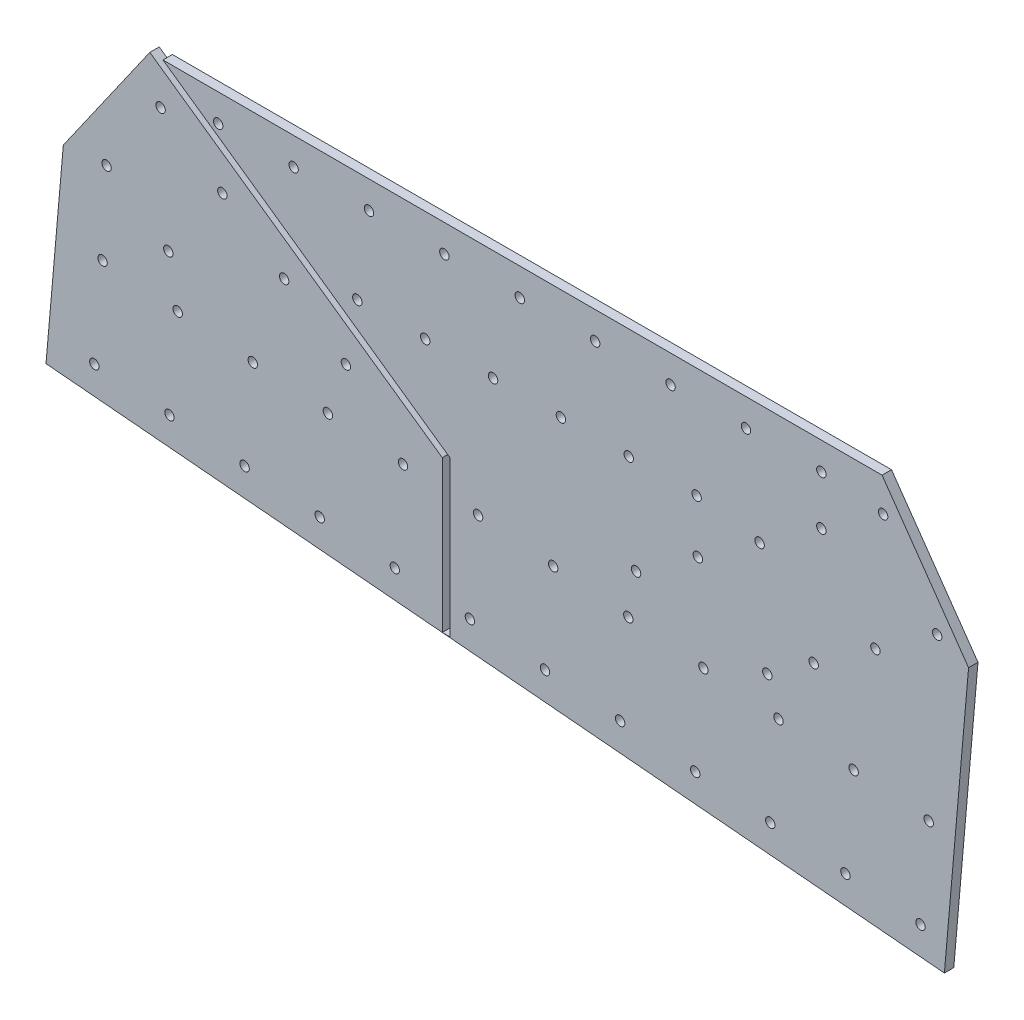
from build123d import *

# Parameters (mm, degrees)
BOSS_EXTRUDE1_DEPTH = 3.175
SKETCH2_R           = 1.5875
CUT_EXTRUDE1_DEPTH  = 3.175
CUT_EXTRUDE2_REACH  = 379.721


with BuildPart() as part:
    # Sketch1 → Boss-Extrude1 (new body)
    with BuildSketch(Plane.XY):
        Polygon((-79.850081257, 25.4), (-50.712398291, -16.21292385), (-58.863628506, -109.381911546), (-361.522202617, -82.902717393), (-355.687601709, -16.21292385), (-326.549918742, 25.4), align=None)
    extrude(amount=BOSS_EXTRUDE1_DEPTH)

    # Sketch2 → Cut-Extrude1 (cut)
    with BuildSketch(Plane.XY.offset(3.175)):
        with Locations((-66.89523724, -99.240960223)):
            Circle(SKETCH2_R)
        with Locations((-92.198582572, -97.027204357)):
            Circle(SKETCH2_R)
        with Locations((-117.501927903, -94.813448491)):
            Circle(SKETCH2_R)
        with Locations((-142.805273235, -92.599692625)):
            Circle(SKETCH2_R)
        with Locations((-168.108618566, -90.38593676)):
            Circle(SKETCH2_R)
        with Locations((-193.411963898, -88.172180894)):
            Circle(SKETCH2_R)
        with Locations((-218.715309229, -85.958425028)):
            Circle(SKETCH2_R)
        with Locations((-244.018654561, -83.744669162)):
            Circle(SKETCH2_R)
        with Locations((-269.321999892, -81.530913296)):
            Circle(SKETCH2_R)
        with Locations((-294.625345224, -79.317157431)):
            Circle(SKETCH2_R)
        with Locations((-319.928690555, -77.103401565)):
            Circle(SKETCH2_R)
        with Locations((-345.232035887, -74.889645699)):
            Circle(SKETCH2_R)
        with Locations((-89.431387739, -65.398022693)):
            Circle(SKETCH2_R)
        with Locations((-114.734733071, -63.184266827)):
            Circle(SKETCH2_R)
        with Locations((-140.038078403, -60.970510961)):
            Circle(SKETCH2_R)
        with Locations((-165.341423734, -58.756755095)):
            Circle(SKETCH2_R)
        with Locations((-190.644769066, -56.542999229)):
            Circle(SKETCH2_R)
        with Locations((-215.948114397, -54.329243364)):
            Circle(SKETCH2_R)
        with Locations((-241.251459729, -52.115487498)):
            Circle(SKETCH2_R)
        with Locations((-266.55480506, -49.901731632)):
            Circle(SKETCH2_R)
        with Locations((-291.858150392, -47.687975766)):
            Circle(SKETCH2_R)
        with Locations((-317.161495723, -45.4742199)):
            Circle(SKETCH2_R)
        with Locations((-342.464841055, -43.260464035)):
            Circle(SKETCH2_R)
        with Locations((-64.128042408, -67.611778558)):
            Circle(SKETCH2_R)
        with Locations((-61.290585417, -11.821231321)):
            Circle(SKETCH2_R)
        with Locations((-82.097047342, -26.390072805)):
            Circle(SKETCH2_R)
        with Locations((-102.903509267, -40.958914288)):
            Circle(SKETCH2_R)
        with Locations((-118.508355711, -51.8855454)):
            Circle(SKETCH2_R)
        with Locations((-162.727484971, -44.088519848)):
            Circle(SKETCH2_R)
        with Locations((-141.921023046, -29.519678365)):
            Circle(SKETCH2_R)
        with Locations((-121.114561121, -14.950836882)):
            Circle(SKETCH2_R)
        with Locations((-100.308099196, -0.381995398)):
            Circle(SKETCH2_R)
        with Locations((-79.501637271, 14.186846085)):
            Circle(SKETCH2_R)
        with Locations((-100.308099196, 16.139754211)):
            Circle(SKETCH2_R)
        with Locations((-125.708099196, 16.139754211)):
            Circle(SKETCH2_R)
        with Locations((-151.108099196, 16.139754211)):
            Circle(SKETCH2_R)
        with Locations((-176.508099196, 16.139754211)):
            Circle(SKETCH2_R)
        with Locations((-201.908099196, 16.139754211)):
            Circle(SKETCH2_R)
        with Locations((-227.308099196, 16.139754211)):
            Circle(SKETCH2_R)
        with Locations((-252.708099196, 16.139754211)):
            Circle(SKETCH2_R)
        with Locations((-278.108099196, 16.139754211)):
            Circle(SKETCH2_R)
        with Locations((-303.508099196, 16.139754211)):
            Circle(SKETCH2_R)
        with Locations((-142.330186502, -11.821231321)):
            Circle(SKETCH2_R)
        with Locations((-165.190186502, -11.821231321)):
            Circle(SKETCH2_R)
        with Locations((-188.050186502, -11.821231321)):
            Circle(SKETCH2_R)
        with Locations((-210.910186502, -11.821231321)):
            Circle(SKETCH2_R)
        with Locations((-233.770186502, -11.821231321)):
            Circle(SKETCH2_R)
        with Locations((-256.630186502, -11.821231321)):
            Circle(SKETCH2_R)
        with Locations((-322.907708372, 11.114849959)):
            Circle(SKETCH2_R)
        with Locations((-341.118760226, -14.893227447)):
            Circle(SKETCH2_R)
        with Locations((-302.101246447, -3.453991524)):
            Circle(SKETCH2_R)
        with Locations((-281.294784522, -18.022833007)):
            Circle(SKETCH2_R)
        with Locations((-260.488322597, -32.591674491)):
            Circle(SKETCH2_R)
        with Locations((-320.312298301, -29.46206893)):
            Circle(SKETCH2_R)
    extrude(amount=-CUT_EXTRUDE1_DEPTH, mode=Mode.SUBTRACT)

    # Sketch3 → Cut-Extrude2 (cut, up to next)
    with BuildSketch(Plane(origin=(0, 0, 0), x_dir=(-1, 0, 0), z_dir=(0, 0, -1)), mode=Mode.PRIVATE) as cut_extrude2_sk1:
        Polygon((228.024558259, -94.582247881), (228.024558259, -43.588200115), (326.549918742, 25.4), (322.121563882, 25.4), (225.484558259, -42.265959807), (225.484558259, -94.582247881), align=None)
    cut_extrude2_tool1 = extrude(cut_extrude2_sk1.sketch, amount=-CUT_EXTRUDE2_REACH, mode=Mode.PRIVATE) & part.part
    add(cut_extrude2_tool1.solids().sort_by_distance((-226.455802, -69.085224, 0))[0], mode=Mode.SUBTRACT)


with BuildPart() as cut_extrude2_piece_1:
    # of the separate pieces the step leaves, piece 1, a body of its own (cut_extrude2_pieces)
    add(part.part.solids().sort_by_distance((-79.850081257, 25.4, 0))[0])


with BuildPart() as cut_extrude2_piece_2:
    # of the separate pieces the step leaves, piece 2, a body of its own (cut_extrude2_pieces)
    add(part.part.solids().sort_by_distance((-355.687601709, -16.21292385, 0))[0])


solid = Compound([cut_extrude2_piece_1.part, cut_extrude2_piece_2.part])
